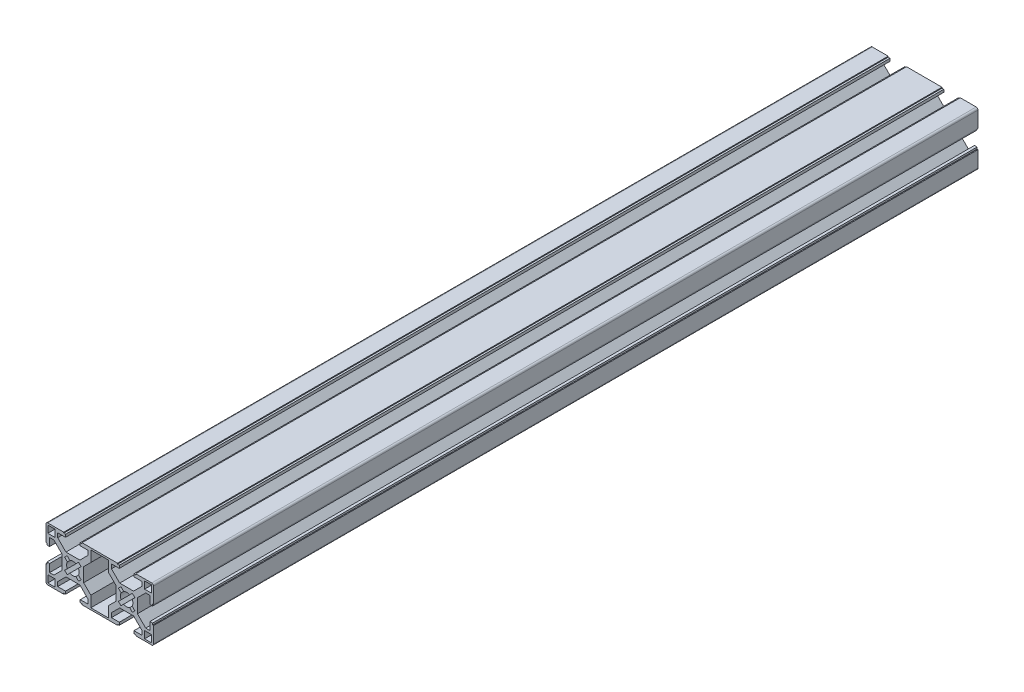
from build123d import *

# Parameters (mm, degrees)
ESBO_O1_W                      = 4
ESBO_O1_H                      = 4
RESSALTO_EXTRUS_O1_DEPTH       = 460
PADR_OCIRCULAR1_COUNT          = 4
PADR_O_LINEAR1_COUNT           = 2
PADR_O_LINEAR1_PITCH           = 30
PADR_O_LINEAR1_COPY_1_SKETCH_W = 4
PADR_O_LINEAR1_COPY_1_SKETCH_H = 4
PADR_O_LINEAR1_COPY_1_DEPTH    = 460
PADR_O_LINEAR1_COPY_2_SKETCH_W = 4
PADR_O_LINEAR1_COPY_2_SKETCH_H = 4
PADR_O_LINEAR1_COPY_2_DEPTH    = 460
PADR_O_LINEAR1_COPY_3_SKETCH_W = 4
PADR_O_LINEAR1_COPY_3_SKETCH_H = 4
PADR_O_LINEAR1_COPY_3_DEPTH    = 460
ESBO_O4_W                      = 10
ESBO_O4_H                      = 28
CORTE_EXTRUS_O1_DEPTH          = 463.439185191
FILETE1_R                      = 1


with BuildPart() as part:
    # Esboço1 → Ressalto-extrusão1 (new body)
    with BuildSketch(Plane.XY):
        with BuildLine():
            ThreePointArc((-1.664601464, 3.078815026), (-0.858529967, 3.393070335), (0, 3.5))
            Line((0, 3.5), (0, 6))
            Line((0, 6), (-3.878679656, 6))
            Line((-3.878679656, 6), (-8.5, 10.621320344))
            Line((-8.5, 10.621320344), (-8.5, 13))
            Line((-8.5, 13), (-4.1, 13))
            Line((-4.1, 13), (-4.1, 14.5))
            Line((-4.1, 14.5), (-5.1, 14.5))
            Line((-5.1, 14.5), (-5.1, 15))
            Line((-5.1, 15), (-15, 15))
            Line((-15, 15), (-15, 5.1))
            Line((-15, 5.1), (-14.5, 5.1))
            Line((-14.5, 5.1), (-14.5, 4.1))
            Line((-14.5, 4.1), (-13, 4.1))
            Line((-13, 4.1), (-13, 8.5))
            Line((-13, 8.5), (-10.621320344, 8.5))
            Line((-10.621320344, 8.5), (-6, 3.878679656))
            Line((-6, 3.878679656), (-6, 0))
            Line((-6, 0), (-3.5, 0))
            ThreePointArc((-3.5, 0), (-3.393070335, 0.858529967), (-3.078815026, 1.664601464))
            Line((-3.078815026, 1.664601464), (-4.596194078, 3.181980515))
            Line((-4.596194078, 3.181980515), (-3.181980515, 4.596194078))
            Line((-3.181980515, 4.596194078), (-1.664601464, 3.078815026))
        make_face()
        with Locations((-12, 12)):
            Rectangle(ESBO_O1_W, ESBO_O1_H, mode=Mode.SUBTRACT)
    ressalto_extrus_o1 = extrude(amount=RESSALTO_EXTRUS_O1_DEPTH)

    # PadrãoCircular1: Ressalto-extrusão1 ×4 about axis
    padr_ocircular1_axis = Axis((0, 0, 0), (0, 0, 1))
    for i in range(1, PADR_OCIRCULAR1_COUNT):
        add(ressalto_extrus_o1.rotate(padr_ocircular1_axis, i * 360 / PADR_OCIRCULAR1_COUNT))

    # Padrão linear1: Ressalto-extrusão1 ×2
    with Locations(*[(i * PADR_O_LINEAR1_PITCH, 0, 0) for i in range(1, PADR_O_LINEAR1_COUNT)]):
        add(ressalto_extrus_o1)

    # Padrão linear1 copy 1 sketch → Padrão linear1 copy 1 (add)
    with BuildSketch(Plane(origin=(30, 0, 0), x_dir=(0, 1, 0), z_dir=(0, 0, 1))):
        with BuildLine():
            ThreePointArc((-1.664601464, 3.078815026), (-0.858529967, 3.393070335), (0, 3.5))
            Line((0, 3.5), (0, 6))
            Line((0, 6), (-3.878679656, 6))
            Line((-3.878679656, 6), (-8.5, 10.621320344))
            Line((-8.5, 10.621320344), (-8.5, 13))
            Line((-8.5, 13), (-4.1, 13))
            Line((-4.1, 13), (-4.1, 14.5))
            Line((-4.1, 14.5), (-5.1, 14.5))
            Line((-5.1, 14.5), (-5.1, 15))
            Line((-5.1, 15), (-15, 15))
            Line((-15, 15), (-15, 5.1))
            Line((-15, 5.1), (-14.5, 5.1))
            Line((-14.5, 5.1), (-14.5, 4.1))
            Line((-14.5, 4.1), (-13, 4.1))
            Line((-13, 4.1), (-13, 8.5))
            Line((-13, 8.5), (-10.621320344, 8.5))
            Line((-10.621320344, 8.5), (-6, 3.878679656))
            Line((-6, 3.878679656), (-6, 0))
            Line((-6, 0), (-3.5, 0))
            ThreePointArc((-3.5, 0), (-3.393070335, 0.858529967), (-3.078815026, 1.664601464))
            Line((-3.078815026, 1.664601464), (-4.596194078, 3.181980515))
            Line((-4.596194078, 3.181980515), (-3.181980515, 4.596194078))
            Line((-3.181980515, 4.596194078), (-1.664601464, 3.078815026))
        make_face()
        with Locations((-12, 12)):
            Rectangle(PADR_O_LINEAR1_COPY_1_SKETCH_W, PADR_O_LINEAR1_COPY_1_SKETCH_H, mode=Mode.SUBTRACT)
    extrude(amount=PADR_O_LINEAR1_COPY_1_DEPTH)

    # Padrão linear1 copy 2 sketch → Padrão linear1 copy 2 (add)
    with BuildSketch(Plane(origin=(30, 0, 0), x_dir=(-1, 0, 0), z_dir=(0, 0, 1))):
        with BuildLine():
            ThreePointArc((-1.664601464, 3.078815026), (-0.858529967, 3.393070335), (0, 3.5))
            Line((0, 3.5), (0, 6))
            Line((0, 6), (-3.878679656, 6))
            Line((-3.878679656, 6), (-8.5, 10.621320344))
            Line((-8.5, 10.621320344), (-8.5, 13))
            Line((-8.5, 13), (-4.1, 13))
            Line((-4.1, 13), (-4.1, 14.5))
            Line((-4.1, 14.5), (-5.1, 14.5))
            Line((-5.1, 14.5), (-5.1, 15))
            Line((-5.1, 15), (-15, 15))
            Line((-15, 15), (-15, 5.1))
            Line((-15, 5.1), (-14.5, 5.1))
            Line((-14.5, 5.1), (-14.5, 4.1))
            Line((-14.5, 4.1), (-13, 4.1))
            Line((-13, 4.1), (-13, 8.5))
            Line((-13, 8.5), (-10.621320344, 8.5))
            Line((-10.621320344, 8.5), (-6, 3.878679656))
            Line((-6, 3.878679656), (-6, 0))
            Line((-6, 0), (-3.5, 0))
            ThreePointArc((-3.5, 0), (-3.393070335, 0.858529967), (-3.078815026, 1.664601464))
            Line((-3.078815026, 1.664601464), (-4.596194078, 3.181980515))
            Line((-4.596194078, 3.181980515), (-3.181980515, 4.596194078))
            Line((-3.181980515, 4.596194078), (-1.664601464, 3.078815026))
        make_face()
        with Locations((-12, 12)):
            Rectangle(PADR_O_LINEAR1_COPY_2_SKETCH_W, PADR_O_LINEAR1_COPY_2_SKETCH_H, mode=Mode.SUBTRACT)
    extrude(amount=PADR_O_LINEAR1_COPY_2_DEPTH)

    # Padrão linear1 copy 3 sketch → Padrão linear1 copy 3 (add)
    with BuildSketch(Plane(origin=(30, 0, 0), x_dir=(0, -1, 0), z_dir=(0, 0, 1))):
        with BuildLine():
            ThreePointArc((-1.664601464, 3.078815026), (-0.858529967, 3.393070335), (0, 3.5))
            Line((0, 3.5), (0, 6))
            Line((0, 6), (-3.878679656, 6))
            Line((-3.878679656, 6), (-8.5, 10.621320344))
            Line((-8.5, 10.621320344), (-8.5, 13))
            Line((-8.5, 13), (-4.1, 13))
            Line((-4.1, 13), (-4.1, 14.5))
            Line((-4.1, 14.5), (-5.1, 14.5))
            Line((-5.1, 14.5), (-5.1, 15))
            Line((-5.1, 15), (-15, 15))
            Line((-15, 15), (-15, 5.1))
            Line((-15, 5.1), (-14.5, 5.1))
            Line((-14.5, 5.1), (-14.5, 4.1))
            Line((-14.5, 4.1), (-13, 4.1))
            Line((-13, 4.1), (-13, 8.5))
            Line((-13, 8.5), (-10.621320344, 8.5))
            Line((-10.621320344, 8.5), (-6, 3.878679656))
            Line((-6, 3.878679656), (-6, 0))
            Line((-6, 0), (-3.5, 0))
            ThreePointArc((-3.5, 0), (-3.393070335, 0.858529967), (-3.078815026, 1.664601464))
            Line((-3.078815026, 1.664601464), (-4.596194078, 3.181980515))
            Line((-4.596194078, 3.181980515), (-3.181980515, 4.596194078))
            Line((-3.181980515, 4.596194078), (-1.664601464, 3.078815026))
        make_face()
        with Locations((-12, 12)):
            Rectangle(PADR_O_LINEAR1_COPY_3_SKETCH_W, PADR_O_LINEAR1_COPY_3_SKETCH_H, mode=Mode.SUBTRACT)
    extrude(amount=PADR_O_LINEAR1_COPY_3_DEPTH)

    # Esboço4 → Corte-extrusão1 (cut, through all)
    with BuildSketch(Plane(origin=(0, 0, 0), x_dir=(-1, 0, 0), z_dir=(0, 0, -1))):
        with Locations((-15, 0)):
            Rectangle(ESBO_O4_W, ESBO_O4_H)
    extrude(amount=-CORTE_EXTRUS_O1_DEPTH, mode=Mode.SUBTRACT)

    # Filete1
    filete1_edges = [part.edges().sort_by_distance(p)[0] for p in [
        (45, -15, 230),
        (45, 15, 230),
        (-15, 15, 230),
        (-15, -15, 230),
    ]]
    fillet(filete1_edges, radius=FILETE1_R)


solid = part.part
